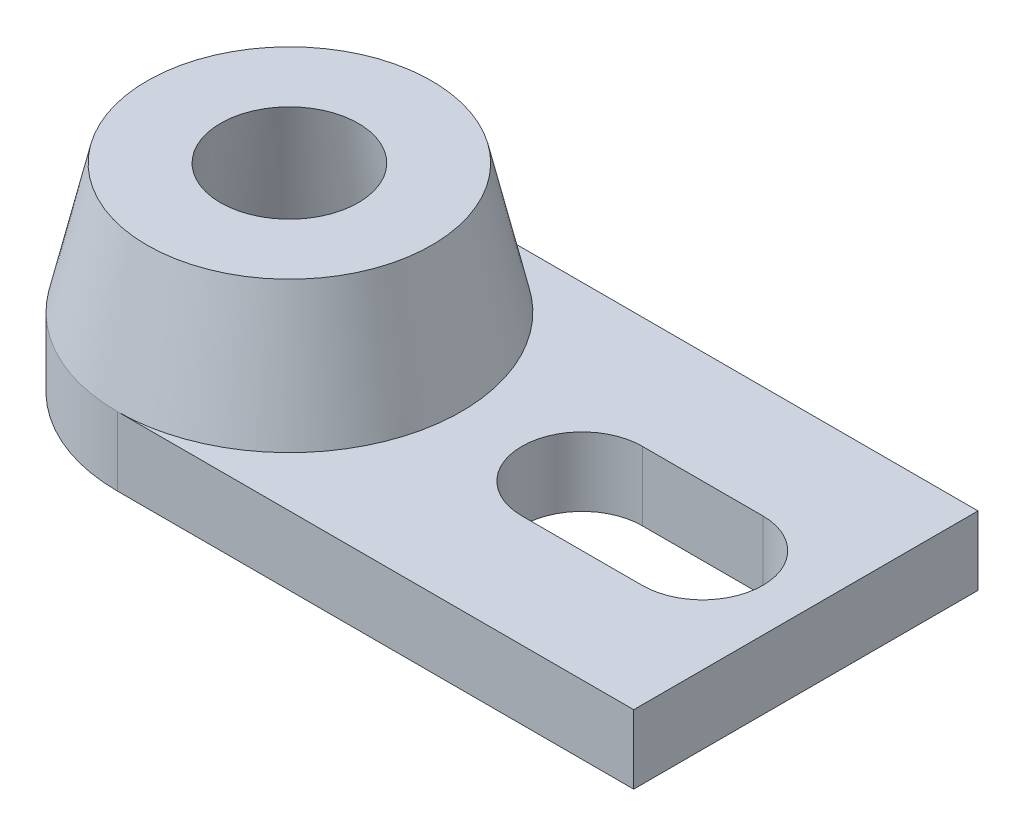
from build123d import *

# Parameters (mm, degrees)
SALIENTE_EXTRUIR1_DEPTH = 8
SALIENTE_EXTRUIR2_DEPTH = 15
SALIENTE_EXTRUIR2_TAPER = 13
CROQUIS3_R              = 8
CORTAR_EXTRUIR1_DEPTH   = 68.297845463
CORTAR_EXTRUIR1_DRAFT   = 10


with BuildPart() as part:
    # Croquis1 → Saliente-Extruir1 (new body)
    with BuildSketch(Plane(origin=(0, 0, 0), x_dir=(1, 0, 0), z_dir=(0, 1, 0))):
        with BuildLine():
            Line((0, 20), (60, 20))
            Line((60, 20), (60, -20))
            Line((60, -20), (0, -20))
            ThreePointArc((0, -20), (-20, 0), (0, 20))
        make_face()
        with BuildLine():
            Line((48, -7), (34, -7))
            ThreePointArc((34, -7), (27, 0), (34, 7))
            Line((34, 7), (48, 7))
            ThreePointArc((48, 7), (55, 0), (48, -7))
        make_face(mode=Mode.SUBTRACT)
    extrude(amount=SALIENTE_EXTRUIR1_DEPTH)

    # Croquis2 → Saliente-Extruir2 (add)
    with BuildSketch(Plane(origin=(0, 8, 0), x_dir=(1, 0, 0), z_dir=(0, 1, 0))):
        with BuildLine():
            ThreePointArc((0, 20), (-20, 0), (0, -20))
            ThreePointArc((0, -20), (14.142135624, -14.142135624), (20, 0))
            ThreePointArc((20, 0), (14.142135624, 14.142135624), (0, 20))
        make_face()
    extrude(amount=SALIENTE_EXTRUIR2_DEPTH, taper=SALIENTE_EXTRUIR2_TAPER)


with BuildPart() as cortar_extruir1_tool:
    # Croquis3 → Cortar-Extruir1 (with draft: the straight prism first)
    with BuildSketch(Plane(origin=(0, 23, 0), x_dir=(1, 0, 0), z_dir=(0, 1, 0))):
        Circle(CROQUIS3_R)
    extrude(amount=-CORTAR_EXTRUIR1_DEPTH)
    # Cortar-Extruir1: the draft: its side faces are tilted about the plane it starts from
    cortar_extruir1_sides = [cortar_extruir1_tool.faces().sort_by_distance(p)[0] for p in [
        (-8, -11.148922732, 0),
    ]]
    draft(cortar_extruir1_sides, Plane(origin=(0, 23, 0), x_dir=(1, 0, 0), z_dir=(0, 1, 0)), CORTAR_EXTRUIR1_DRAFT)


with BuildPart() as part_1:
    add(part.part)

    # Cortar-Extruir1: cut by cortar_extruir1_tool
    add(cortar_extruir1_tool.part, mode=Mode.SUBTRACT)


solid = part_1.part
